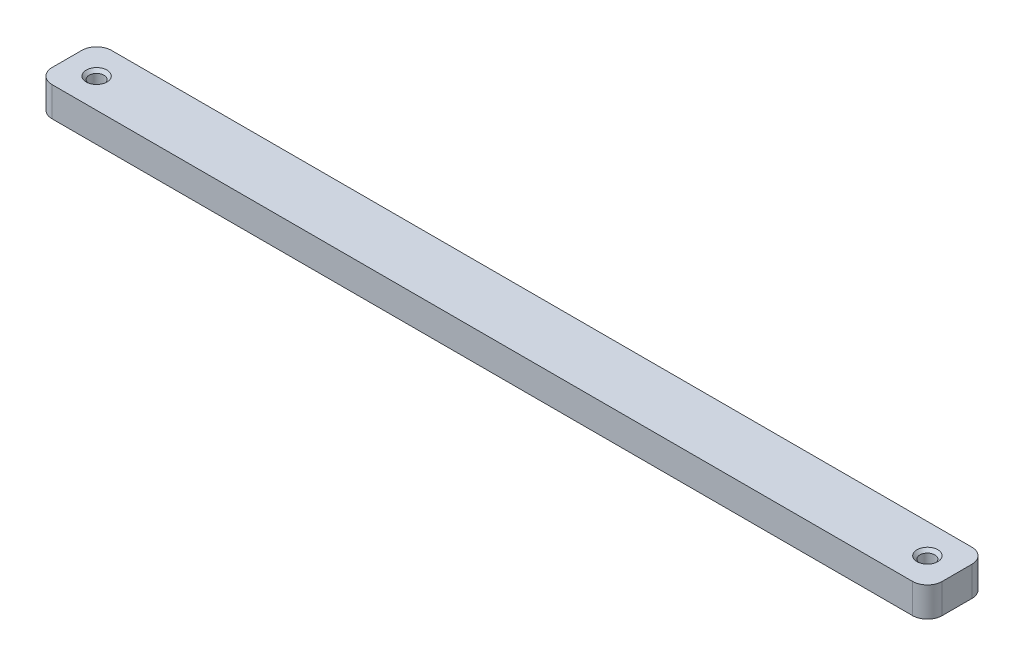
from build123d import *

# Parameters (mm, degrees)
SCHIZZO1_W                      = 300
SCHIZZO1_H                      = 20
ESTRUSIONE_ESTRUSIONE1_DEPTH    = 10
FORO_FILETTATO_M6_1_D           = 5
FORO_FILETTATO_M6_1_DEPTH       = 11
FORO_FILETTATO_M6_1_CSINK_D     = 7
FORO_FILETTATO_M6_1_CSINK_ANGLE = 90
FORO_FILETTATO_M6_1_TIP         = 1.502151548
RACCORDO1_R                     = 5


with BuildPart() as part:
    # Schizzo1 → Estrusione-Estrusione1 (new body)
    with BuildSketch(Plane(origin=(0, 0, 0), x_dir=(1, 0, 0), z_dir=(0, 1, 0))):
        Rectangle(SCHIZZO1_W, SCHIZZO1_H)
    extrude(amount=ESTRUSIONE_ESTRUSIONE1_DEPTH)

    # Foro filettato M6-1
    with Locations(Plane(origin=(0, 10, 0), x_dir=(-1, 0, 0), z_dir=(0, 1, 0))):
        with Locations((140, 0), (-140, 0)):
            CounterSinkHole(FORO_FILETTATO_M6_1_D / 2, FORO_FILETTATO_M6_1_CSINK_D / 2, depth=FORO_FILETTATO_M6_1_DEPTH, counter_sink_angle=FORO_FILETTATO_M6_1_CSINK_ANGLE)
            with Locations((0, 0, -(FORO_FILETTATO_M6_1_DEPTH + FORO_FILETTATO_M6_1_TIP / 2))):  # 118° drill point
                Cone(0, FORO_FILETTATO_M6_1_D / 2, FORO_FILETTATO_M6_1_TIP, mode=Mode.SUBTRACT)

    # Raccordo1
    raccordo1_edges = [part.edges().sort_by_distance(p)[0] for p in [
        (-150, 5, -10),
        (150, 5, -10),
        (150, 5, 10),
        (-150, 5, 10),
    ]]
    fillet(raccordo1_edges, radius=RACCORDO1_R)


solid = part.part
